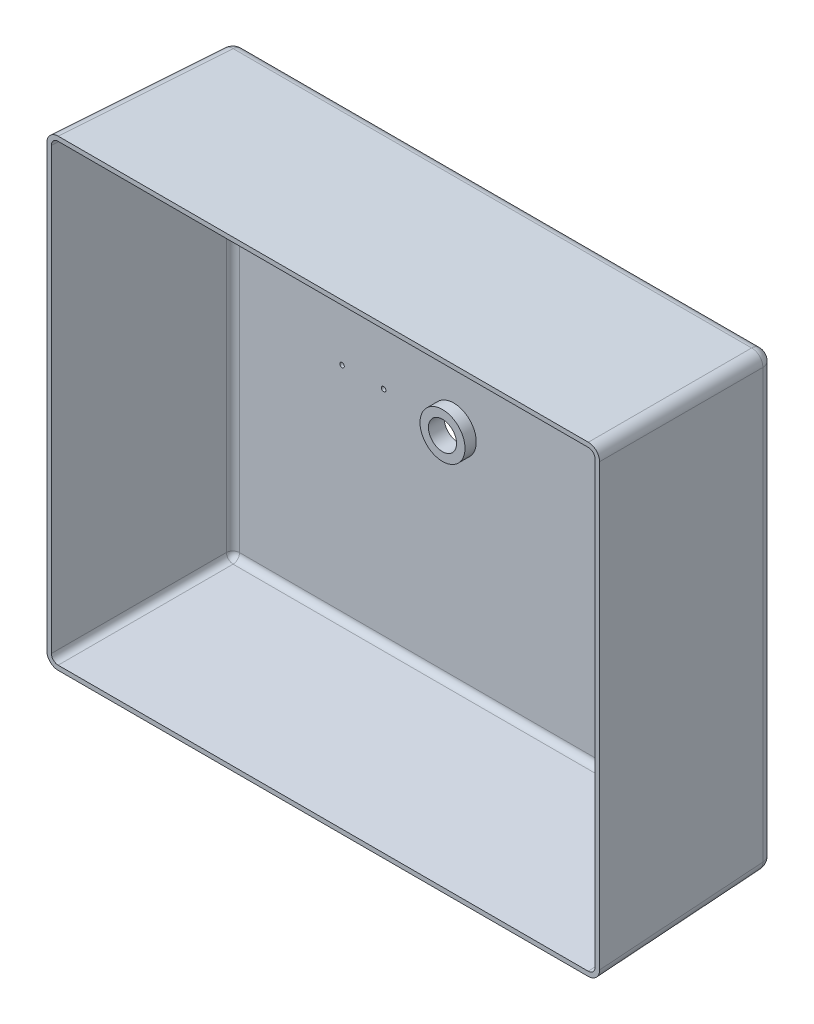
from build123d import *

# Parameters (mm, degrees)
SKETCH1_W                        = 609.6
SKETCH1_H                        = 508
EXTRUDE1_DEPTH                   = 203.2
EXTRUDE1_DRAFT                   = -2
FILLET1_R                        = 12.7
SHELL1_T                         = -5.08
SKETCH2_R                        = 25.4
EXTRUDE2_DEPTH                   = 12.7
EXTRUDE2_DRAFT                   = 2
EXTRUDE2_PROFILE_2_DEPTH         = 12.7
EXTRUDE2_PROFILE_2_DRAFT         = 2
EXTRUDE2_PROFILE_3_DEPTH         = 12.7
EXTRUDE2_PROFILE_3_DRAFT         = 2
EXTRUDE2_PROFILE_4_DEPTH         = 12.7
EXTRUDE2_PROFILE_4_DRAFT         = 2
FILLET2_R                        = 2.54
SKETCH3_R                        = 25.4
EXTRUDE3_DEPTH                   = 12.7
F_1_1_DIAMETER_HOLE1_D           = 31.75
F_3_8_0_375_DIAMETER_HOLE1_D     = 9.525
F_3_8_0_375_DIAMETER_HOLE2_D     = 9.525
F_3_8_0_375_DIAMETER_HOLE2_DEPTH = 17.78
F_3_8_0_375_DIAMETER_HOLE2_TIP   = 2.861598698
CIRPATTERN1_COUNT                = 3
F_10_CLEARANCE_HOLE1_D           = 5.1054
LPATTERN1_COUNT                  = 2
LPATTERN1_PITCH                  = 46.99


with BuildPart() as part:
    # Sketch1 → Extrude1 (with draft: the straight prism first)
    with BuildSketch(Plane.XY):
        with Locations((304.8, 254)):
            Rectangle(SKETCH1_W, SKETCH1_H)
    extrude(amount=EXTRUDE1_DEPTH)
    # Extrude1: the draft: its side faces are tilted about the plane it starts from
    extrude1_sides = [part.faces().sort_by_distance(p)[0] for p in [
        (304.8, 0, 101.6),
        (609.6, 254, 101.6),
        (304.8, 508, 101.6),
        (0, 254, 101.6),
    ]]
    draft(extrude1_sides, Plane.XY, EXTRUDE1_DRAFT)

    # Fillet1
    fillet1_edges = [part.edges().sort_by_distance(p)[0] for p in [
        (304.8, 508, 0),
        (609.6, 254, 0),
        (304.8, 0, 0),
        (0, 254, 0),
        (-3.54795018, 511.54795018, 101.6),
        (613.14795018, 511.54795018, 101.6),
        (613.14795018, -3.54795018, 101.6),
        (-3.54795018, -3.54795018, 101.6),
    ]]
    fillet(fillet1_edges, radius=FILLET1_R)

    # Shell1
    shell1_openings = [part.faces().sort_by_distance(p)[0] for p in [
        (304.8, 254, 203.2),
    ]]
    offset(amount=SHELL1_T, openings=shell1_openings, kind=Kind.INTERSECTION)


with BuildPart() as extrude2_tool:
    # Sketch2 → Extrude2 (with draft: the straight prism first)
    with BuildSketch(Plane(origin=(0, 0, 0), x_dir=(-1, 0, 0), z_dir=(0, 0, -1))):
        with Locations((-558.8, 50.8)):
            Circle(SKETCH2_R)
    extrude(amount=EXTRUDE2_DEPTH)
    # Extrude2: the draft: its side faces are tilted about the plane it starts from
    extrude2_sides = [extrude2_tool.faces().sort_by_distance(p)[0] for p in [
        (584.2, 50.8, -6.35),
    ]]
    draft(extrude2_sides, Plane(origin=(0, 0, 0), x_dir=(-1, 0, 0), z_dir=(0, 0, -1)), EXTRUDE2_DRAFT)


with BuildPart() as part_1:
    add(part.part)

    # Extrude2: add extrude2_tool
    add(extrude2_tool.part)


with BuildPart() as extrude2_profile_2_tool:
    # Sketch2 → Extrude2 profile 2 (with draft: the straight prism first)
    with BuildSketch(Plane(origin=(0, 0, 0), x_dir=(-1, 0, 0), z_dir=(0, 0, -1))):
        with Locations((-50.8, 50.8)):
            Circle(SKETCH2_R)
    extrude(amount=EXTRUDE2_PROFILE_2_DEPTH)
    # Extrude2 profile 2: the draft: its side faces are tilted about the plane it starts from
    extrude2_profile_2_sides = [extrude2_profile_2_tool.faces().sort_by_distance(p)[0] for p in [
        (76.2, 50.8, -6.35),
    ]]
    draft(extrude2_profile_2_sides, Plane(origin=(0, 0, 0), x_dir=(-1, 0, 0), z_dir=(0, 0, -1)), EXTRUDE2_PROFILE_2_DRAFT)


with BuildPart() as part_2:
    add(part_1.part)

    # Extrude2 profile 2: add extrude2_profile_2_tool
    add(extrude2_profile_2_tool.part)


with BuildPart() as extrude2_profile_3_tool:
    # Sketch2 → Extrude2 profile 3 (with draft: the straight prism first)
    with BuildSketch(Plane(origin=(0, 0, 0), x_dir=(-1, 0, 0), z_dir=(0, 0, -1))):
        with Locations((-558.8, 457.2)):
            Circle(SKETCH2_R)
    extrude(amount=EXTRUDE2_PROFILE_3_DEPTH)
    # Extrude2 profile 3: the draft: its side faces are tilted about the plane it starts from
    extrude2_profile_3_sides = [extrude2_profile_3_tool.faces().sort_by_distance(p)[0] for p in [
        (584.2, 457.2, -6.35),
    ]]
    draft(extrude2_profile_3_sides, Plane(origin=(0, 0, 0), x_dir=(-1, 0, 0), z_dir=(0, 0, -1)), EXTRUDE2_PROFILE_3_DRAFT)


with BuildPart() as part_3:
    add(part_2.part)

    # Extrude2 profile 3: add extrude2_profile_3_tool
    add(extrude2_profile_3_tool.part)


with BuildPart() as extrude2_profile_4_tool:
    # Sketch2 → Extrude2 profile 4 (with draft: the straight prism first)
    with BuildSketch(Plane(origin=(0, 0, 0), x_dir=(-1, 0, 0), z_dir=(0, 0, -1))):
        with Locations((-50.8, 457.2)):
            Circle(SKETCH2_R)
    extrude(amount=EXTRUDE2_PROFILE_4_DEPTH)
    # Extrude2 profile 4: the draft: its side faces are tilted about the plane it starts from
    extrude2_profile_4_sides = [extrude2_profile_4_tool.faces().sort_by_distance(p)[0] for p in [
        (76.2, 457.2, -6.35),
    ]]
    draft(extrude2_profile_4_sides, Plane(origin=(0, 0, 0), x_dir=(-1, 0, 0), z_dir=(0, 0, -1)), EXTRUDE2_PROFILE_4_DRAFT)


with BuildPart() as part_4:
    add(part_3.part)

    # Extrude2 profile 4: add extrude2_profile_4_tool
    add(extrude2_profile_4_tool.part)

    # Fillet2
    fillet2_edges = [part_4.edges().sort_by_distance(p)[0] for p in [
        (584.2, 50.8, 0),
        (583.756506227, 50.8, -12.7),
        (76.2, 50.8, 0),
        (75.756506227, 50.8, -12.7),
        (584.2, 457.2, 0),
        (583.756506227, 457.2, -12.7),
        (76.2, 457.2, 0),
        (75.756506227, 457.2, -12.7),
    ]]
    fillet(fillet2_edges, radius=FILLET2_R)

    # Sketch3 → Extrude3 (add)
    with BuildSketch(Plane.XY.offset(5.08)):
        with Locations(Location((254, 254, 0), (0, 0, 180))):
            Circle(SKETCH3_R)
    extrude(amount=EXTRUDE3_DEPTH)

    # 1 (1) Diameter Hole1 (through all)
    with Locations(Plane(origin=(254, 254, 17.78), x_dir=(1, 0, 0), z_dir=(0, 0, 1))):
        with Locations((0, 0)):
            Hole(F_1_1_DIAMETER_HOLE1_D / 2)

    # 3/8 (0.375) Diameter Hole1 (through all)
    with Locations(Plane(origin=(508, 469.9, 5.08), x_dir=(1, 0, 0), z_dir=(0, 0, 1))):
        with Locations((0, 0)):
            f_3_8_0_375_diameter_hole1 = Hole(F_3_8_0_375_DIAMETER_HOLE1_D / 2)

    # 3/8 (0.375) Diameter Hole2
    with Locations(Plane.XY.offset(5.08)):
        with Locations((508, 406.4)):
            Hole(F_3_8_0_375_DIAMETER_HOLE2_D / 2, depth=F_3_8_0_375_DIAMETER_HOLE2_DEPTH)
            with Locations((0, 0, -(F_3_8_0_375_DIAMETER_HOLE2_DEPTH + F_3_8_0_375_DIAMETER_HOLE2_TIP / 2))):  # 118° drill point
                Cone(0, F_3_8_0_375_DIAMETER_HOLE2_D / 2, F_3_8_0_375_DIAMETER_HOLE2_TIP, mode=Mode.SUBTRACT)

    # CirPattern1: 3/8 (0.375) Diameter Hole1 ×3 about axis
    cirpattern1_axis = Axis((508, 406.4, 0), (0, 0, 1))
    for i in range(1, CIRPATTERN1_COUNT):
        add(f_3_8_0_375_diameter_hole1.rotate(cirpattern1_axis, i * 360 / CIRPATTERN1_COUNT), mode=Mode.SUBTRACT)

    # #10 Clearance Hole1 (through all)
    with Locations(Plane(origin=(127.90678, 253.42088, 0), x_dir=(-1, 0, 0), z_dir=(0, 0, -1))):
        with Locations((0, 0)):
            f_10_clearance_hole1 = Hole(F_10_CLEARANCE_HOLE1_D / 2)

    # LPattern1: #10 Clearance Hole1 ×2
    with Locations(*[(i * LPATTERN1_PITCH, 0, 0) for i in range(1, LPATTERN1_COUNT)]):
        add(f_10_clearance_hole1, mode=Mode.SUBTRACT)


solid = part_4.part
